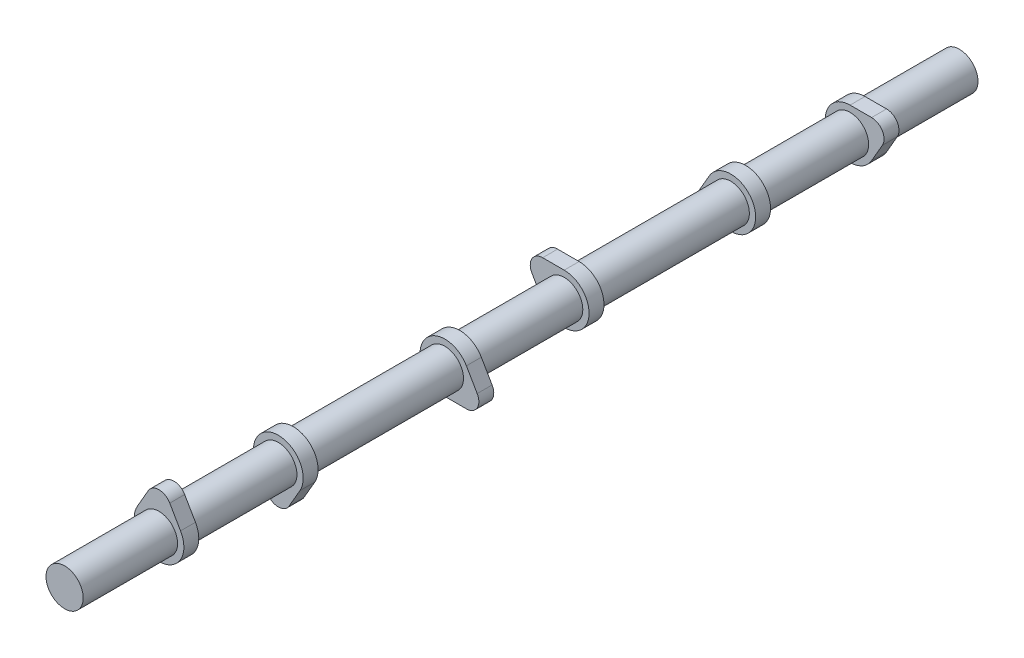
from build123d import *

# Parameters (mm, degrees)
BOSS_EXTRUDE1_DEPTH   = 3.81
LPATTERN1_COUNT       = 2
LPATTERN1_PITCH       = 60.94
LPATTERN2_COUNT       = 2
LPATTERN2_PITCH       = 85.06
LPATTERN3_COUNT       = 2
LPATTERN3_PITCH       = 60.94
LPATTERN5_COUNT       = 2
LPATTERN5_PITCH       = 85.06
LPATTERN6_COUNT       = 2
LPATTERN6_PITCH       = 60.94
BODY_MOVE_COPY1_ANGLE = 180
BODY_MOVE_COPY2_ANGLE = 120
BODY_MOVE_COPY3_ANGLE = 120
SKETCH2_R             = 9.5
BOSS_EXTRUDE2_DEPTH   = 228.49


with BuildPart() as part:
    # Sketch1 → Boss-Extrude1 (new, symmetric)
    with BuildSketch(Plane.XY):
        with BuildLine():
            Line((5.499261314, 15.875), (10.998522628, 6.35))
            ThreePointArc((10.998522628, 6.35), (0, -12.7), (-10.998522628, 6.35))
            Line((-10.998522628, 6.35), (-5.499261314, 15.875))
            ThreePointArc((-5.499261314, 15.875), (0, 19.05), (5.499261314, 15.875))
        make_face()
    extrude(amount=BOSS_EXTRUDE1_DEPTH, both=True)


with BuildPart() as lpattern1_1:
    # LPattern1: pattern copy
    add(part.part.moved(Location(Vector(0, 0, 1) * (1 * LPATTERN1_PITCH))))


with BuildPart() as lpattern2_1:
    # LPattern2: pattern copy
    add(lpattern1_1.part.moved(Location(Vector(0, 0, 1) * (1 * LPATTERN2_PITCH))))


with BuildPart() as lpattern3_1:
    # LPattern3: pattern copy
    add(lpattern2_1.part.moved(Location(Vector(0, 0, 1) * (1 * LPATTERN3_PITCH))))


with BuildPart() as lpattern5_1:
    # LPattern5: pattern copy
    add(lpattern3_1.part.moved(Location(Vector(0, 0, 1) * (1 * LPATTERN5_PITCH))))


with BuildPart() as lpattern6_1:
    # LPattern6: pattern copy
    add(lpattern5_1.part.moved(Location(Vector(0, 0, 1) * (1 * LPATTERN6_PITCH))))


with BuildPart() as lpattern5_1_1:
    # Body-Move/Copy1: moved
    add(lpattern5_1.part.rotate(Axis((0, 0, 0), (0, 0, 1)), BODY_MOVE_COPY1_ANGLE))


with BuildPart() as lpattern2_1_1:
    # Body-Move/Copy1: moved
    add(lpattern2_1.part.rotate(Axis((0, 0, 0), (0, 0, 1)), BODY_MOVE_COPY1_ANGLE))


with BuildPart() as part_1:
    # Body-Move/Copy1: moved
    add(part.part.rotate(Axis((0, 0, 0), (0, 0, 1)), BODY_MOVE_COPY1_ANGLE))


with BuildPart() as lpattern3_1_1:
    # Body-Move/Copy2: moved
    add(lpattern3_1.part.rotate(Axis((0, 0, 0), (0, 0, -1)), BODY_MOVE_COPY2_ANGLE))


with BuildPart() as lpattern2_1_2:
    # Body-Move/Copy2: moved
    add(lpattern2_1_1.part.rotate(Axis((0, 0, 0), (0, 0, -1)), BODY_MOVE_COPY2_ANGLE))


with BuildPart() as lpattern1_1_1:
    # Body-Move/Copy3: moved
    add(lpattern1_1.part.rotate(Axis((0, 0, 0), (0, 0, 1)), BODY_MOVE_COPY3_ANGLE))


with BuildPart() as part_2:
    # Body-Move/Copy3: moved
    add(part_1.part.rotate(Axis((0, 0, 0), (0, 0, 1)), BODY_MOVE_COPY3_ANGLE))


    add(lpattern1_1_1.part)  # Boss-Extrude2 merges LPattern1_1

    add(lpattern2_1_2.part)  # Boss-Extrude2 merges LPattern2_1

    add(lpattern3_1_1.part)  # Boss-Extrude2 merges LPattern3_1

    add(lpattern5_1_1.part)  # Boss-Extrude2 merges LPattern5_1

    add(lpattern6_1.part)  # Boss-Extrude2 merges LPattern6_1
    # Sketch2 → Boss-Extrude2 (add, symmetric)
    with BuildSketch(Plane(origin=(0, 0, 176.47), x_dir=(-1, 0, 0), z_dir=(0, 0, -1))):
        Circle(SKETCH2_R)
    extrude(amount=BOSS_EXTRUDE2_DEPTH, both=True)


solid = part_2.part
